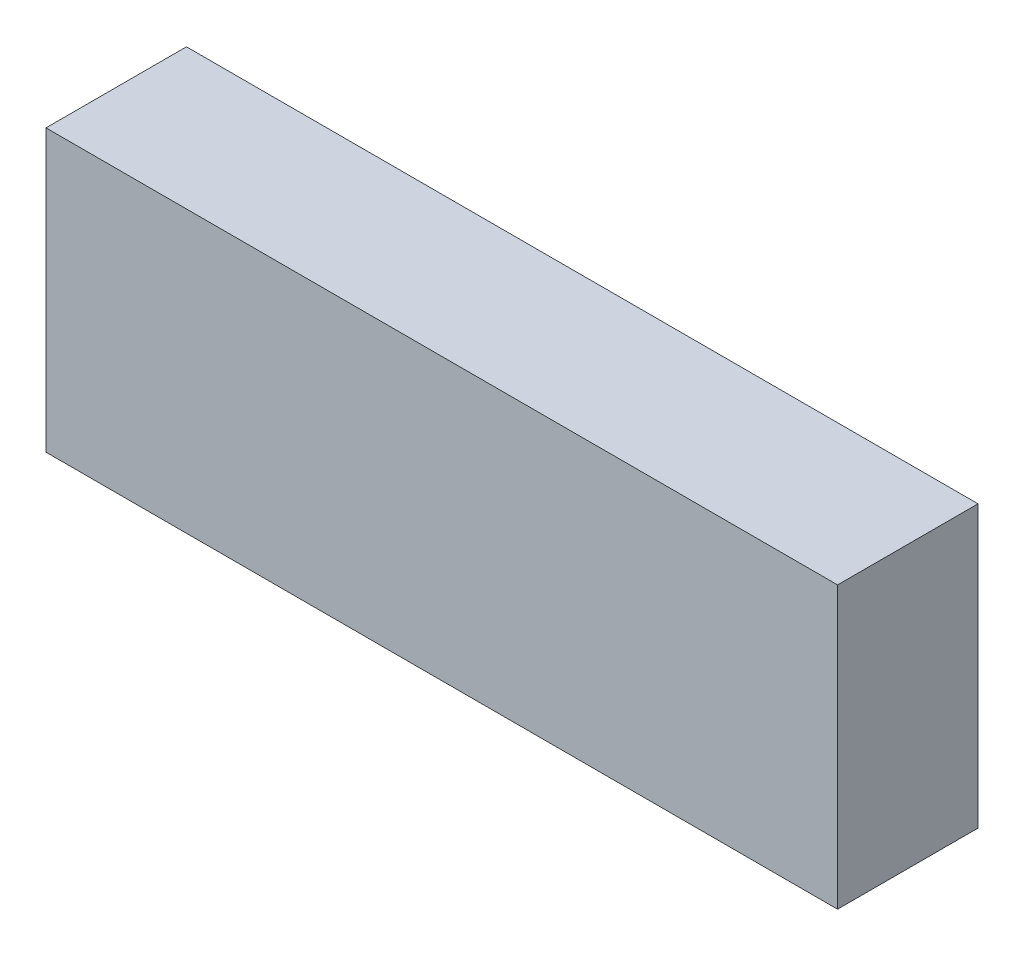
from build123d import *

# Parameters (mm, degrees)
SKETCH1_W           = 31
SKETCH1_H           = 11
BOSS_EXTRUDE1_DEPTH = 5.5


with BuildPart() as part:
    # Sketch1 → Boss-Extrude1 (new body)
    with BuildSketch(Plane.XY):
        with Locations((-8.926829268, -1.542682927)):
            Rectangle(SKETCH1_W, SKETCH1_H)
    extrude(amount=BOSS_EXTRUDE1_DEPTH)


solid = part.part
